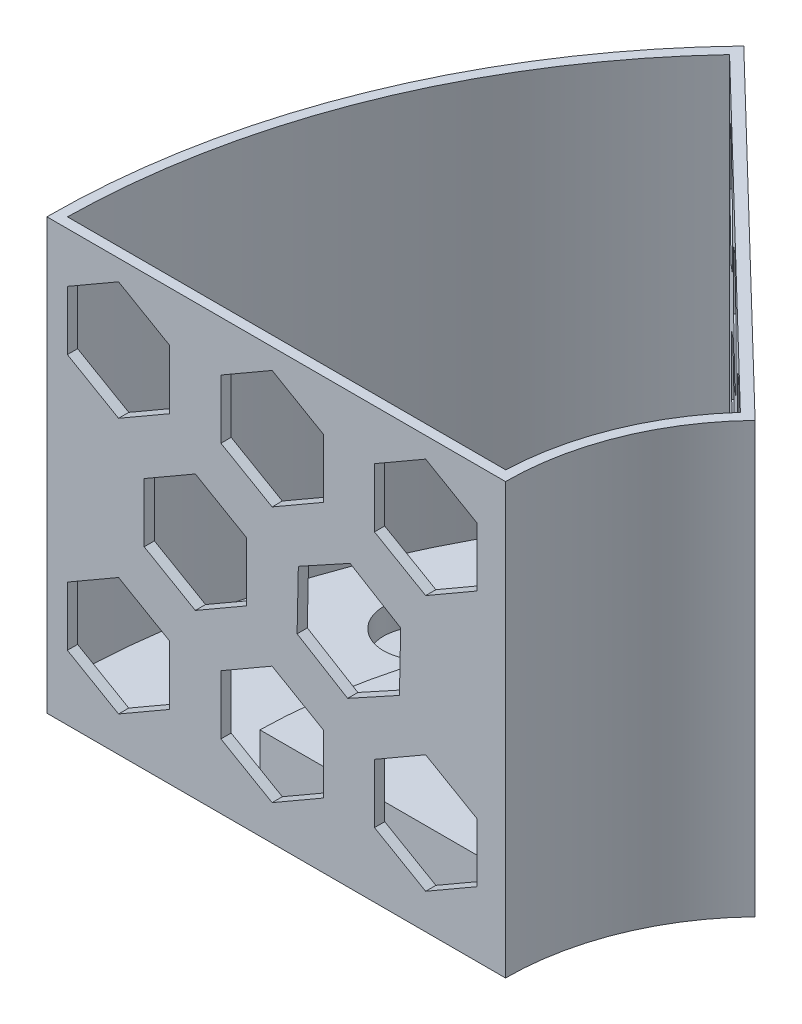
from build123d import *

# Parameters (mm, degrees)
SALIENTE_EXTRUIR1_DEPTH = 40
VACIADO1_T              = -1
SALIENTE_EXTRUIR3_START = 2
SALIENTE_EXTRUIR3_DEPTH = 2
CROQUIS5_R              = 3.75
CORTAR_EXTRUIR2_DEPTH   = 2.5
SALIENTE_EXTRUIR5_DEPTH = 5
CORTAR_EXTRUIR3_DEPTH   = 6
CORTAR_EXTRUIR4_DEPTH   = 1
CORTAR_EXTRUIR5_DEPTH   = 1


with BuildPart() as part:
    # Croquis1 → Saliente-Extruir1 (new body)
    with BuildSketch(Plane(origin=(0, 0, 0), x_dir=(1, 0, 0), z_dir=(0, 1, 0))):
        with BuildLine():
            Line((-25, 0), (-69.8, 0))
            ThreePointArc((-69.8, 0), (-64.717433049, 26.14754022), (-50.209918064, 48.487154258))
            Line((-50.209918064, 48.487154258), (-17.983495008, 17.366459261))
            ThreePointArc((-17.983495008, 17.366459261), (-23.179596364, 9.365164835), (-25, 0))
        make_face()
    extrude(amount=SALIENTE_EXTRUIR1_DEPTH)

    # Vaciado1
    vaciado1_openings = [part.faces().sort_by_distance(p)[0] for p in [
        (-46.068338787, 40, -18.61281705),
    ]]
    offset(amount=VACIADO1_T, openings=vaciado1_openings, kind=Kind.INTERSECTION)

    # Croquis4 → Saliente-Extruir3 (add)
    with BuildSketch(Plane.XZ.offset(SALIENTE_EXTRUIR3_START)):
        with BuildLine():
            Line((-25, 0), (-69.8, 0))
            ThreePointArc((-69.8, 0), (-64.717433049, -26.14754022), (-50.209918064, -48.487154258))
            Line((-50.209918064, -48.487154258), (-17.983495008, -17.366459261))
            ThreePointArc((-17.983495008, -17.366459261), (-23.179596364, -9.365164835), (-25, 0))
        make_face()
    extrude(amount=-SALIENTE_EXTRUIR3_DEPTH)

    # Croquis5 → Cortar-Extruir2 (cut)
    with BuildSketch(Plane(origin=(0, 1, 0), x_dir=(1, 0, 0), z_dir=(0, 1, 0))):
        with Locations(Location((-55.631031274, 22.476395605, 0), (0, 0, 270))):
            Circle(CROQUIS5_R)
    extrude(amount=-CORTAR_EXTRUIR2_DEPTH, mode=Mode.SUBTRACT)

    # Croquis6 → Saliente-Extruir5 (add)
    with BuildSketch(Plane(origin=(0, 1, 0), x_dir=(1, 0, 0), z_dir=(0, 1, 0))):
        with BuildLine():
            Line((-25, 0), (-50, 0))
            ThreePointArc((-50, 0), (-46.359192728, 18.730329671), (-35.966990017, 34.732918523))
            Line((-35.966990017, 34.732918523), (-17.983495008, 17.366459261))
            ThreePointArc((-17.983495008, 17.366459261), (-23.179596364, 9.365164835), (-25, 0))
        make_face()
    extrude(amount=SALIENTE_EXTRUIR5_DEPTH)

    # Croquis2 → Cortar-Extruir3 (cut)
    with BuildSketch(Plane(origin=(0, -2, 0), x_dir=(1, 0, 0), z_dir=(0, 1, 0))):
        with BuildLine():
            Line((-39.728874148, 27.818457163), (-29.899049617, 20.935539927))
            ThreePointArc((-29.899049617, 20.935539927), (-33.842210692, 13.67314066), (-36.050624432, 5.709857974))
            Line((-36.050624432, 5.709857974), (-47.902884519, 7.587071554))
            ThreePointArc((-47.902884519, 7.587071554), (-44.968416946, 18.168419781), (-39.728874148, 27.818457163))
        make_face()
    extrude(amount=CORTAR_EXTRUIR3_DEPTH, mode=Mode.SUBTRACT)

    # Croquis7 → Cortar-Extruir4 (cut)
    with BuildSketch(Plane.XY):
        Polygon((-62.8, 38), (-67.8, 35.113248654), (-67.8, 29.339745962), (-62.8, 26.452994616), (-57.8, 29.339745962), (-57.8, 35.113248654), align=None)
        Polygon((-47.8, 38), (-52.8, 35.113248654), (-52.8, 29.339745962), (-47.8, 26.452994616), (-42.8, 29.339745962), (-42.8, 35.113248654), align=None)
        Polygon((-32.8, 38), (-37.8, 35.113248654), (-37.8, 29.339745962), (-32.8, 26.452994616), (-27.8, 29.339745962), (-27.8, 35.113248654), align=None)
        Polygon((-47.8, 12.983724512), (-52.8, 10.096973166), (-52.8, 4.323470474), (-47.8, 1.436719129), (-42.8, 4.323470474), (-42.8, 10.096973166), align=None)
        Polygon((-32.8, 12.983724512), (-37.8, 10.096973166), (-37.8, 4.323470474), (-32.8, 1.436719129), (-27.8, 4.323470474), (-27.8, 10.096973166), align=None)
        Polygon((-62.8, 12.983724512), (-67.8, 10.096973166), (-67.8, 4.323470474), (-62.8, 1.436719129), (-57.8, 4.323470474), (-57.8, 10.096973166), align=None)
        Polygon((-55.299341949, 25.491862219), (-60.299670942, 22.605680781), (-60.300328993, 16.832178126), (-55.300658051, 13.94485691), (-50.300329058, 16.831038348), (-50.299671007, 22.604541002), align=None)
        Polygon((-40.177782617, 25.490568521), (-45.237770901, 22.710307401), (-45.359988284, 16.938098444), (-40.422217383, 13.946150607), (-35.362229099, 16.726411727), (-35.240011716, 22.498620684), align=None)
    extrude(amount=-CORTAR_EXTRUIR4_DEPTH, mode=Mode.SUBTRACT)

    # Croquis8 → Cortar-Extruir5 (cut)
    with BuildSketch(Plane(origin=(0, 0, 0), x_dir=(0.7193398003386502, 0, 0.6946583704589984), z_dir=(-0.6946583704589984, 0, 0.7193398003386502))):
        Polygon((-62.8, 38), (-67.8, 35.113248654), (-67.8, 29.339745962), (-62.8, 26.452994616), (-57.8, 29.339745962), (-57.8, 35.113248654), align=None)
        Polygon((-47.8, 38), (-52.8, 35.113248654), (-52.8, 29.339745962), (-47.8, 26.452994616), (-42.8, 29.339745962), (-42.8, 35.113248654), align=None)
        Polygon((-32.8, 38), (-37.8, 35.113248654), (-37.8, 29.339745962), (-32.8, 26.452994616), (-27.8, 29.339745962), (-27.8, 35.113248654), align=None)
        Polygon((-47.8, 12.983724512), (-52.8, 10.096973166), (-52.8, 4.323470474), (-47.8, 1.436719129), (-42.8, 4.323470474), (-42.8, 10.096973166), align=None)
        Polygon((-32.8, 12.983724512), (-37.8, 10.096973166), (-37.8, 4.323470474), (-32.8, 1.436719129), (-27.8, 4.323470474), (-27.8, 10.096973166), align=None)
        Polygon((-62.8, 12.983724512), (-67.8, 10.096973166), (-67.8, 4.323470474), (-62.8, 1.436719129), (-57.8, 4.323470474), (-57.8, 10.096973166), align=None)
        Polygon((-55.299341949, 25.491862219), (-60.299670942, 22.605680781), (-60.300328993, 16.832178126), (-55.300658051, 13.94485691), (-50.300329058, 16.831038348), (-50.299671007, 22.604541002), align=None)
        Polygon((-40.177782617, 25.490568521), (-45.237770901, 22.710307401), (-45.359988284, 16.938098444), (-40.422217383, 13.946150607), (-35.362229099, 16.726411727), (-35.240011716, 22.498620684), align=None)
    extrude(amount=CORTAR_EXTRUIR5_DEPTH, mode=Mode.SUBTRACT)


solid = part.part
